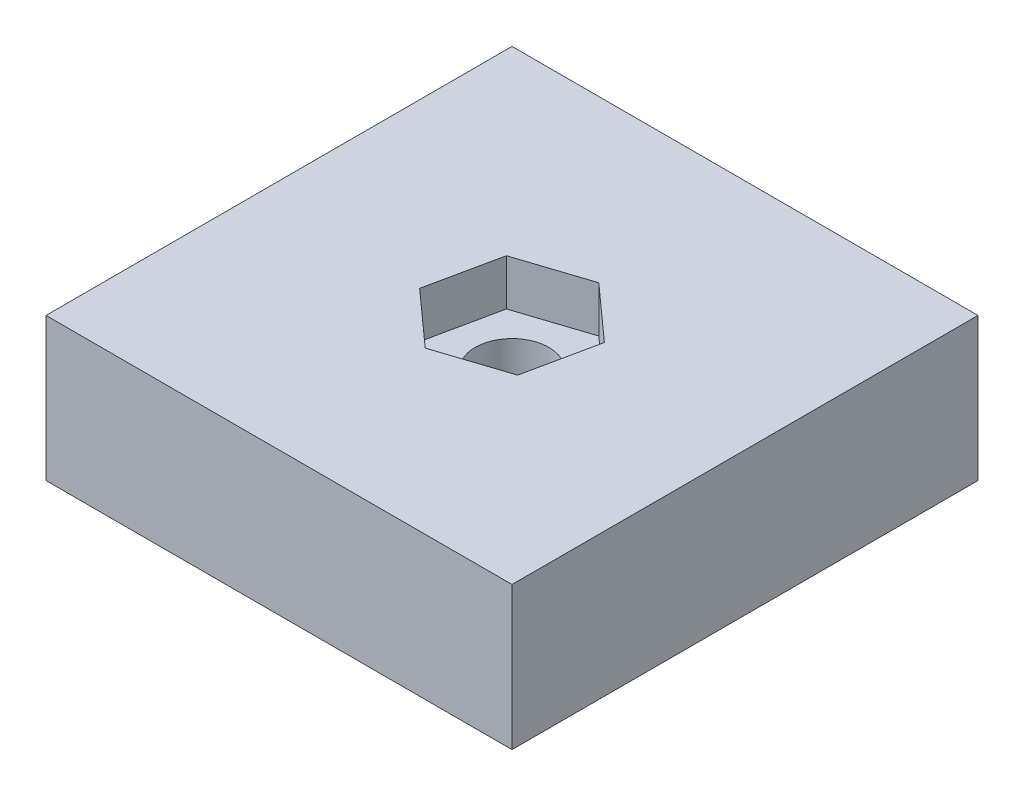
from build123d import *

# Parameters (mm, degrees)
SKETCH1_W                  = 20.2
SKETCH1_H                  = 20.2
BOSS_EXTRUDE1_DEPTH        = 6.2
F_3_2_3_2_DIAMETER_HOLE1_D = 3.2
CUT_EXTRUDE1_START         = -2
SKETCH4_R                  = 1.6
CUT_EXTRUDE1_DEPTH         = 2


with BuildPart() as part:
    # Sketch1 → Boss-Extrude1 (new body)
    with BuildSketch(Plane(origin=(0, 6.2, 0), x_dir=(1, 0, 0), z_dir=(0, 1, 0))):
        with Locations((10.1, -12.9)):
            Rectangle(SKETCH1_W, SKETCH1_H)
    extrude(amount=-BOSS_EXTRUDE1_DEPTH)

    # Ø3.2 (3.2) Diameter Hole1 (through all)
    with Locations(Plane(origin=(0, 6.2, 0), x_dir=(1, 0, 0), z_dir=(0, 1, 0))):
        with Locations((10.1, -12.9)):
            Hole(F_3_2_3_2_DIAMETER_HOLE1_D / 2)

    # Sketch4 → Cut-Extrude1 (cut)
    with BuildSketch(Plane(origin=(0, 6.2, 0), x_dir=(1, 0, 0), z_dir=(0, 1, 0)).offset(CUT_EXTRUDE1_START)):
        Polygon((7.73670062, -10.779115898), (10.75508982, -9.792880649), (13.118389201, -11.913764751), (12.46329938, -15.020884102), (9.44491018, -16.007119351), (7.081610799, -13.886235249), align=None)
        with Locations(Location((10.1, -12.9, 0), (0, 0, 270))):
            Circle(SKETCH4_R, mode=Mode.SUBTRACT)
    extrude(amount=CUT_EXTRUDE1_DEPTH, mode=Mode.SUBTRACT)


solid = part.part
